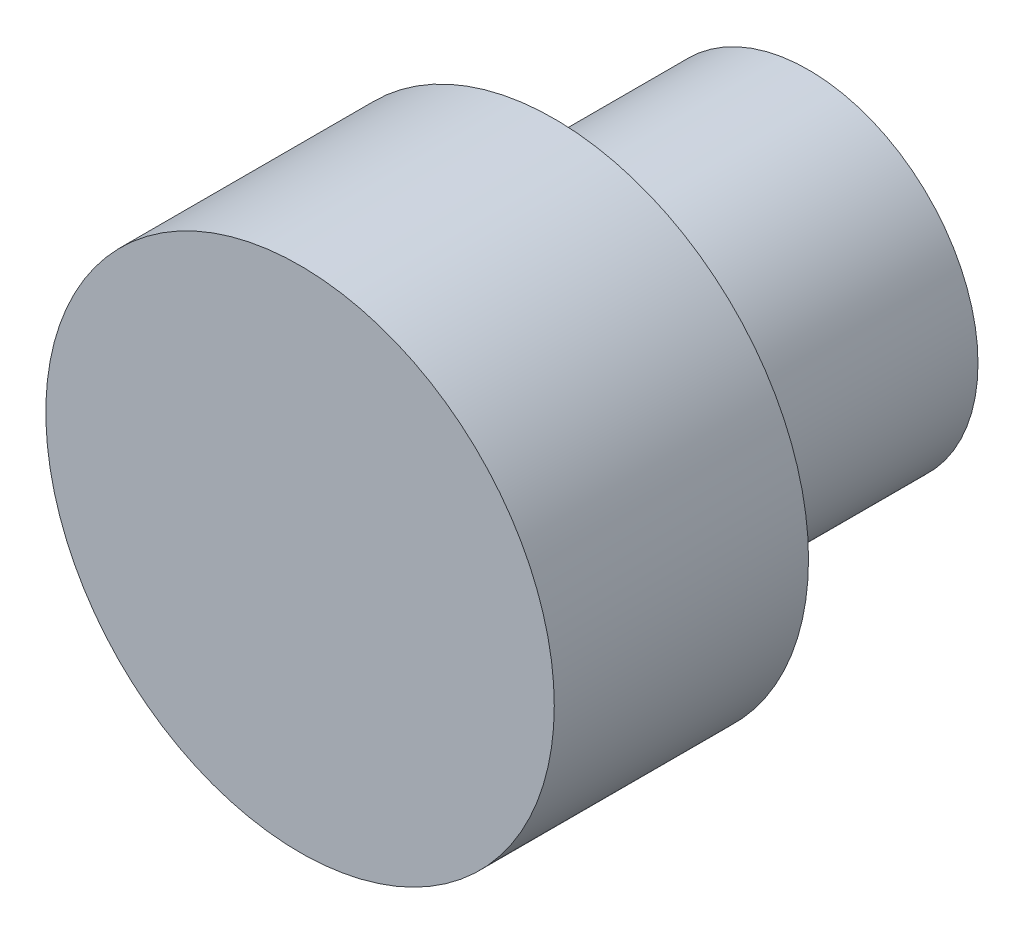
from build123d import *


with BuildPart() as part:
    # 草图1 → 旋转1 (revolve)
    with BuildSketch(Plane(origin=(0, 0, 0), x_dir=(0, 0, -1), z_dir=(1, 0, 0)), mode=Mode.PRIVATE) as revolve_1_sk:
        Polygon((0, 0), (6, 0), (6, 2), (3, 2), (3, 3), (0, 3), align=None)
    revolve(revolve_1_sk.sketch.rotate(Axis((0, 0, 0), (0, 0, -1)), 90), axis=Axis((0, 0, 0), (0, 0, -1)))


solid = part.part
